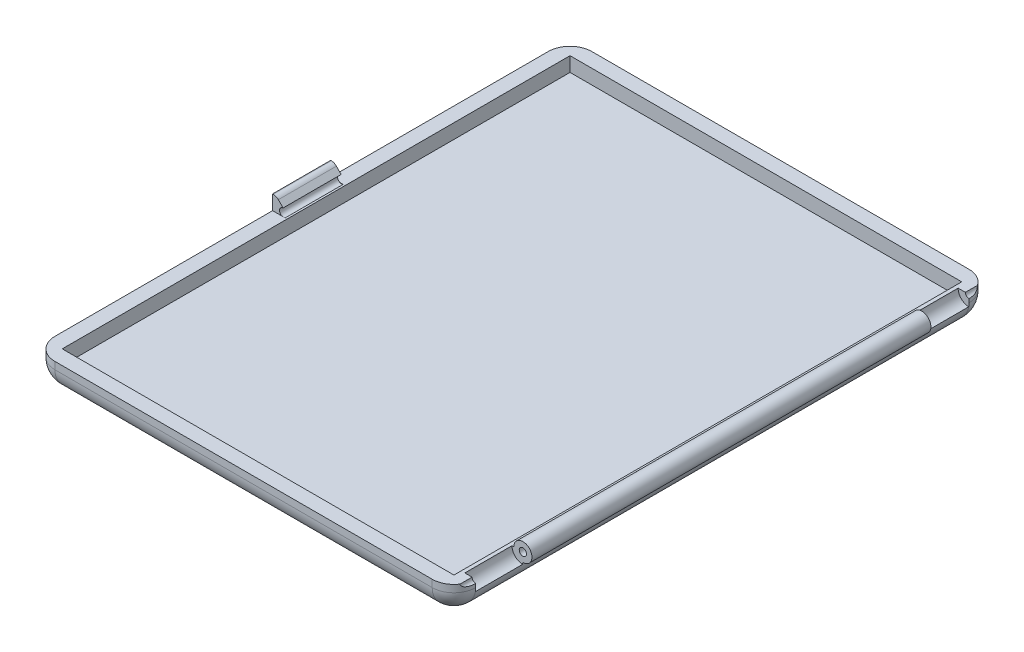
from build123d import *

# Parameters (mm, degrees)
BOTTOM_W                = 58
BOTTOM_H                = 74
BOTTOM_W_2              = 54
BOTTOM_H_2              = 70
DUVAR_DEPTH             = 4
BOTTOM_2_W              = 54
BOTTOM_2_H              = 70
TABAN_DEPTH             = 2
FILLET2_R               = 3
CENTIK_W                = 1.5
CENTIK_H                = 8
CENTIK_CIKINTI_DEPTH    = 2
SKETCH1_R               = 1.5
CUT_EXTRUDE1_DEPTH      = 6.5
CUT_EXTRUDE2_START      = -6.5
MENTESE_OUT_R           = 1.5
CUT_EXTRUDE2_DEPTH      = 6.5
BOSS_EXTRUDE3_START     = -55
SKETCH2_R               = 1.25
BOSS_EXTRUDE3_DEPTH     = 55
CUT_EXTRUDE3_DEPTH      = 92.403295892
CUT_EXTRUDE3_DEPTH_BACK = 92.403295892
MENTESE_IN_R            = 0.5
CHAMFER1_SIZE           = 1
FILLET3_R               = 1
TIRNAK_R                = 0.55
TIRNAK_EX_DEPTH         = 8


with BuildPart() as part:
    # bottom → duvar (new body)
    with BuildSketch(Plane(origin=(0, 0, 0), x_dir=(1, 0, 0), z_dir=(0, 1, 0))):
        with Locations((27, 35)):
            Rectangle(BOTTOM_W, BOTTOM_H)
        with Locations((27, 35)):
            Rectangle(BOTTOM_W_2, BOTTOM_H_2, mode=Mode.SUBTRACT)
    extrude(amount=DUVAR_DEPTH)

    # bottom<2> → taban (add)
    with BuildSketch(Plane(origin=(0, 0, 0), x_dir=(1, 0, 0), z_dir=(0, 1, 0))):
        with Locations((27, 35)):
            Rectangle(BOTTOM_2_W, BOTTOM_2_H)
    extrude(amount=TABAN_DEPTH)

    # Fillet2
    fillet2_edges = [part.edges().sort_by_distance(p)[0] for p in [
        (27, 0, -72),
        (56, 0, -35),
        (27, 0, 2),
        (-2, 0, -35),
        (-2, 2, -72),
        (56, 2, -72),
        (56, 2, 2),
        (-2, 2, 2),
    ]]
    fillet(fillet2_edges, radius=FILLET2_R)

    # centik → centik cikinti (add)
    with BuildSketch(Plane(origin=(0, 4, 0), x_dir=(1, 0, 0), z_dir=(0, 1, 0))):
        with Locations((-1.25, 35)):
            Rectangle(CENTIK_W, CENTIK_H)
    extrude(amount=CENTIK_CIKINTI_DEPTH)

    # Sketch1 → Cut-Extrude1 (cut)
    with BuildSketch(Plane.XY.offset(-1)):
        with Locations((56, 4)):
            Circle(SKETCH1_R)
    extrude(amount=-CUT_EXTRUDE1_DEPTH, mode=Mode.SUBTRACT)

    # mentese out → Cut-Extrude2 (cut)
    with BuildSketch(Plane(origin=(0, 0, -69), x_dir=(-1, 0, 0), z_dir=(0, 0, -1)).offset(CUT_EXTRUDE2_START)):
        with Locations((-56, 4)):
            Circle(MENTESE_OUT_R)
    extrude(amount=CUT_EXTRUDE2_DEPTH, mode=Mode.SUBTRACT)

    # Sketch2 → Boss-Extrude3 (add)
    with BuildSketch(Plane(origin=(0, 0, -62.5), x_dir=(-1, 0, 0), z_dir=(0, 0, -1)).offset(BOSS_EXTRUDE3_START)):
        with Locations((-56, 4)):
            Circle(SKETCH2_R)
    extrude(amount=BOSS_EXTRUDE3_DEPTH)

    # mentese in → Cut-Extrude3 (cut, two sides: drawn at the far end of the back side and taken through both)
    with BuildSketch(Plane.XY.offset(-1).offset(-CUT_EXTRUDE3_DEPTH_BACK)):
        with Locations((56, 4)):
            Circle(MENTESE_IN_R)
    extrude(amount=CUT_EXTRUDE3_DEPTH + CUT_EXTRUDE3_DEPTH_BACK, mode=Mode.SUBTRACT)

    # Chamfer1
    chamfer1_edges = [part.edges().sort_by_distance(p)[0] for p in [
        (-0.5, 6, -35),
    ]]
    chamfer(chamfer1_edges, length=CHAMFER1_SIZE)

    # Fillet3
    fillet3_edges = [part.edges().sort_by_distance(p)[0] for p in [
        (-1.5, 6, -35),
    ]]
    fillet(fillet3_edges, radius=FILLET3_R)

    # tirnak → tirnak ex (cut)
    with BuildSketch(Plane.XY.offset(-31)):
        with Locations((-0.5, 4.5)):
            Circle(TIRNAK_R)
    extrude(amount=-TIRNAK_EX_DEPTH, mode=Mode.SUBTRACT)


solid = part.part
